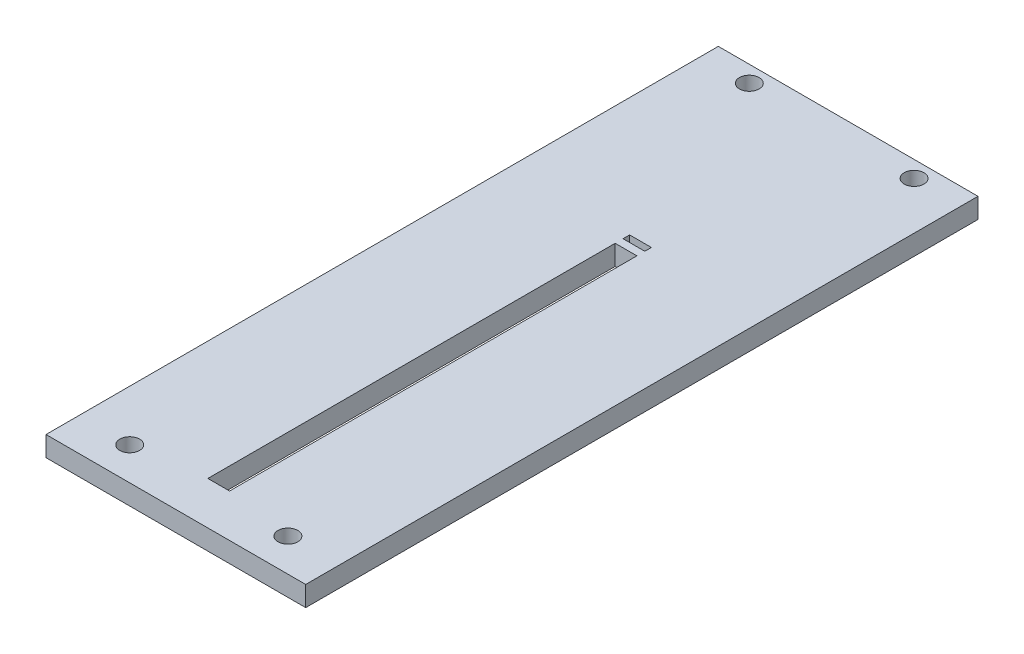
from build123d import *

# Parameters (mm, degrees)
SKETCH1_W             = 39.4
SKETCH1_H             = 102
BOSS_EXTRUDE1_DEPTH   = 3.05
SKETCH4_W             = 1.65
SKETCH4_H             = 1
SKETCH4_H_2           = 61.8
CUT_EXTRUDE1_DEPTH    = 104.929747907
SKETCH7_R             = 1.5
CUT_EXTRUDE4_DEPTH    = 104.929747907
F_3_0MM_DOWEL_HOLE1_D = 3


with BuildPart() as part:
    # Sketch1 → Boss-Extrude1 (new body)
    with BuildSketch(Plane(origin=(0, 0, 0), x_dir=(1, 0, 0), z_dir=(0, 1, 0))):
        with Locations((0, 51)):
            Rectangle(SKETCH1_W, SKETCH1_H)
    extrude(amount=BOSS_EXTRUDE1_DEPTH)

    # Sketch4 → Cut-Extrude1 (cut, through all)
    with BuildSketch(Plane(origin=(0, 3.05, 0), x_dir=(1, 0, 0), z_dir=(0, 1, 0))):
        with Locations((-0.825, 70)):
            Rectangle(SKETCH4_W, SKETCH4_H)
        with Locations((-0.825, 37.4)):
            Rectangle(SKETCH4_W, SKETCH4_H_2)
        with Locations((0.825, 37.4)):
            Rectangle(SKETCH4_W, SKETCH4_H_2)
        with Locations((0.825, 70)):
            Rectangle(SKETCH4_W, SKETCH4_H)
    extrude(amount=-CUT_EXTRUDE1_DEPTH, mode=Mode.SUBTRACT)

    # Sketch7 → Cut-Extrude4 (cut, through all)
    with BuildSketch(Plane(origin=(0, 3.05, 0), x_dir=(1, 0, 0), z_dir=(0, 1, 0))):
        with Locations(Location((-12, 5, 0), (0, 0, 270))):
            Circle(SKETCH7_R)
        with Locations(Location((12, 5, 0), (0, 0, 90))):
            Circle(SKETCH7_R)
    extrude(amount=-CUT_EXTRUDE4_DEPTH, mode=Mode.SUBTRACT)

    # Ø3.0mm Dowel Hole1 (through all)
    with Locations(Plane(origin=(0, 3.05, 0), x_dir=(1, 0, 0), z_dir=(0, 1, 0))):
        with Locations((-12.5, 99.5), (12.5, 99.5)):
            Hole(F_3_0MM_DOWEL_HOLE1_D / 2)


solid = part.part
